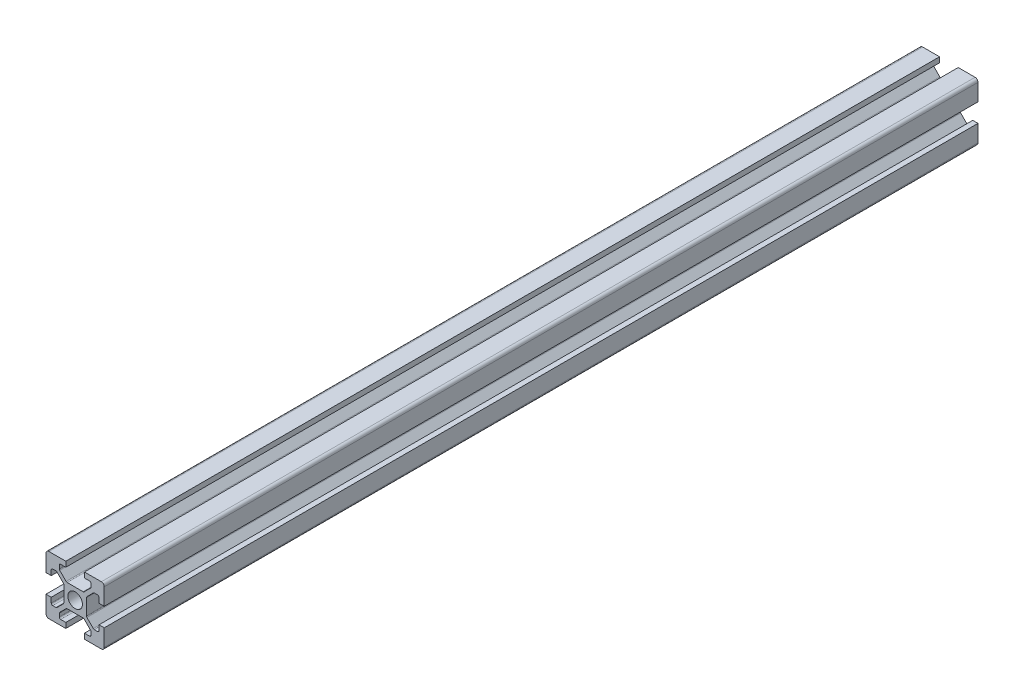
from build123d import *

# Parameters (mm, degrees)
SKETCH1_R           = 2.5
BOSS_EXTRUDE1_DEPTH = 150
FILLET1_R           = 1
FILLET2_R           = 0.5
FILLET3_R           = 0.5
FILLET4_R           = 0.5
FILLET5_R           = 0.5


with BuildPart() as part:
    # Sketch1 → Boss-Extrude1 (new, symmetric)
    with BuildSketch(Plane.XY):
        Polygon((13.2, 0), (13.2, 1.8), (15.45, 1.8), (15.45, 3.6), (12.95, 6.1), (7.05, 6.1), (4.55, 3.6), (4.55, 1.8), (6.8, 1.8), (6.8, 0), (0, 0), (0, 6.8), (1.8, 6.8), (1.8, 4.55), (3.6, 4.55), (6.1, 7.05), (6.1, 12.95), (3.6, 15.45), (1.8, 15.45), (1.8, 13.2), (0, 13.2), (0, 20), (6.8, 20), (6.8, 18.2), (4.55, 18.2), (4.55, 16.4), (7.05, 13.9), (12.95, 13.9), (15.45, 16.4), (15.45, 18.2), (13.2, 18.2), (13.2, 20), (20, 20), (20, 13.2), (18.2, 13.2), (18.2, 15.45), (16.4, 15.45), (13.9, 12.95), (13.9, 7.05), (16.4, 4.55), (18.2, 4.55), (18.2, 6.8), (20, 6.8), (20, 0), align=None)
        with Locations((10, 10)):
            Circle(SKETCH1_R, mode=Mode.SUBTRACT)
    extrude(amount=BOSS_EXTRUDE1_DEPTH, both=True)

    # Fillet1
    fillet1_edges = [part.edges().sort_by_distance(p)[0] for p in [
        (0, 0, 0),
        (0, 20, 0),
        (20, 20, 0),
        (20, 0, 0),
    ]]
    fillet(fillet1_edges, radius=FILLET1_R)

    # Fillet2
    fillet2_edges = [part.edges().sort_by_distance(p)[0] for p in [
        (4.55, 18.2, 0),
        (4.55, 16.4, 0),
        (7.05, 13.9, 0),
        (12.95, 13.9, 0),
        (15.45, 16.4, 0),
        (15.45, 18.2, 0),
    ]]
    fillet(fillet2_edges, radius=FILLET2_R)

    # Fillet3
    fillet3_edges = [part.edges().sort_by_distance(p)[0] for p in [
        (18.2, 15.45, 0),
        (16.4, 15.45, 0),
        (13.9, 12.95, 0),
        (13.9, 7.05, 0),
        (16.4, 4.55, 0),
        (18.2, 4.55, 0),
    ]]
    fillet(fillet3_edges, radius=FILLET3_R)

    # Fillet4
    fillet4_edges = [part.edges().sort_by_distance(p)[0] for p in [
        (1.8, 4.55, 0),
        (3.6, 4.55, 0),
        (6.1, 7.05, 0),
        (6.1, 12.95, 0),
        (3.6, 15.45, 0),
        (1.8, 15.45, 0),
    ]]
    fillet(fillet4_edges, radius=FILLET4_R)

    # Fillet5
    fillet5_edges = [part.edges().sort_by_distance(p)[0] for p in [
        (15.45, 1.8, 0),
        (15.45, 3.6, 0),
        (12.95, 6.1, 0),
        (7.05, 6.1, 0),
        (4.55, 3.6, 0),
        (4.55, 1.8, 0),
    ]]
    fillet(fillet5_edges, radius=FILLET5_R)


solid = part.part
